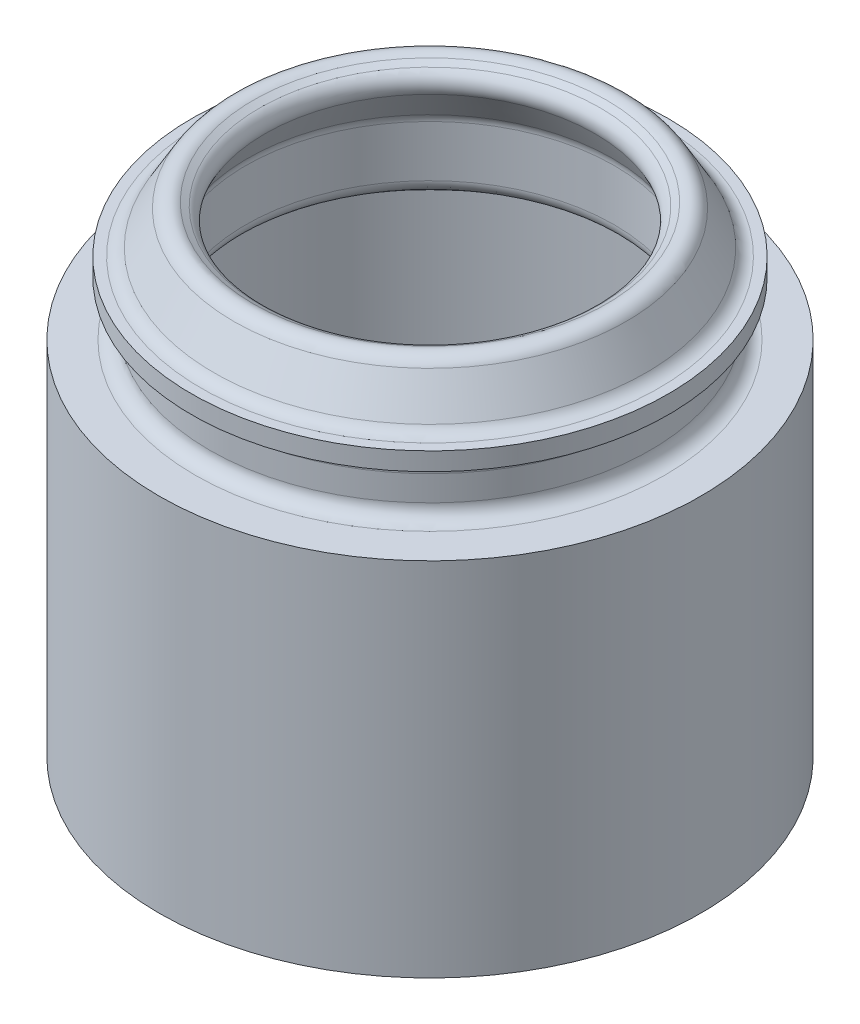
from build123d import *

# Parameters (mm, degrees)
SKETCH1_R           = 7.5
BOSS_EXTRUDE1_DEPTH = 10
SKETCH2_R           = 6.5
CUT_EXTRUDE1_DEPTH  = 8.5


with BuildPart() as part:
    # Sketch1 → Boss-Extrude1 (new body)
    with BuildSketch(Plane(origin=(0, 0, 0), x_dir=(1, 0, 0), z_dir=(0, 1, 0))):
        with Locations(Location((0, 0, 0), (0, 0, 270))):
            Circle(SKETCH1_R)
    extrude(amount=BOSS_EXTRUDE1_DEPTH)

    # Sketch2 → Cut-Extrude1 (cut)
    with BuildSketch(Plane(origin=(0, 10, 0), x_dir=(1, 0, 0), z_dir=(0, 1, 0))):
        with Locations(Location((0, 0, 0), (0, 0, 270))):
            Circle(SKETCH2_R)
    extrude(amount=-CUT_EXTRUDE1_DEPTH, mode=Mode.SUBTRACT)

    # Sketch3 → Revolve1 (revolve)
    with BuildSketch(Plane.XY, mode=Mode.PRIVATE) as revolve1_sk:
        with BuildLine():
            Line((-7, 10), (-6.5, 10))
            ThreePointArc((-6.5, 10), (-6.217157288, 10.117157288), (-6.1, 10.4))
            Line((-6.1, 10.4), (-6.1, 11.1))
            ThreePointArc((-6.1, 11.1), (-6.217157288, 11.382842712), (-6.5, 11.5))
            Line((-6.5, 11.5), (-6.6, 11.5))
            Line((-6.6, 11.5), (-6.6, 12))
            Line((-6.6, 12), (-6.330940108, 12))
            ThreePointArc((-6.330940108, 12), (-6.130940108, 12.053589838), (-5.984529946, 12.2))
            Line((-5.984529946, 12.2), (-5.433974596, 13.153589838))
            ThreePointArc((-5.433974596, 13.153589838), (-5.191092053, 13.339960169), (-4.887564435, 13.3))
            Line((-4.887564435, 13.3), (-4.714359354, 13.2))
            ThreePointArc((-4.714359354, 13.2), (-4.527989023, 12.957117457), (-4.567949192, 12.653589838))
            Line((-4.567949192, 12.653589838), (-5.046410162, 11.824871131))
            ThreePointArc((-5.046410162, 11.824871131), (-5.086370331, 11.728398749), (-5.1, 11.624871131))
            Line((-5.1, 11.624871131), (-5.1, 10.205847158))
            ThreePointArc((-5.1, 10.205847158), (-5.144332943, 10.022814526), (-5.267504723, 9.88035377))
            Line((-5.267504723, 9.88035377), (-6.5, 9))
            Line((-6.5, 9), (-7, 9))
            Line((-7, 9), (-7, 10))
        make_face()
    revolve(revolve1_sk.sketch.rotate(Axis((0, 1.5, 0), (0, 1, 0)), 270), axis=Axis((0, 1.5, 0), (0, 1, 0)))


solid = part.part
